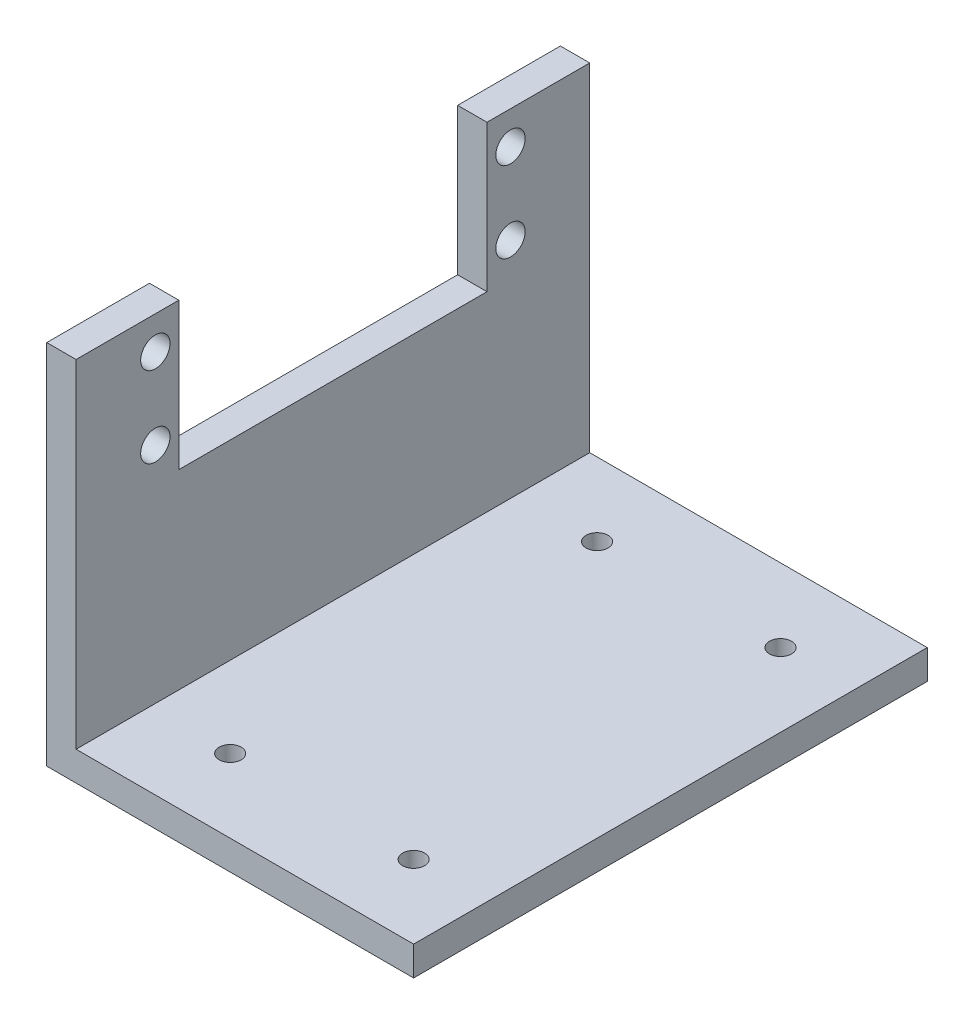
from build123d import *

# Parameters (mm, degrees)
EXTRUSION1_DEPTH                = 70
ESQUISSE2_W                     = 42
ESQUISSE2_H                     = 20
EXTRUSION2_DEPTH                = 70
ESQUISSE4_R                     = 1.5
EXTRUSION3_DEPTH                = 98.549987186
R_P_TITION_LIN_AIRE1_COUNT      = 2
R_P_TITION_LIN_AIRE1_PITCH      = 50
R_P_TITION_LIN_AIRE1_COUNT_DIR2 = 2
R_P_TITION_LIN_AIRE1_PITCH_DIR2 = 25
ESQUISSE5_R                     = 2
ENL_V_MAT_EXTRU_1_DEPTH         = 10
ESQUISSE6_R                     = 2
ENL_V_MAT_EXTRU_2_DEPTH         = 10
ESQUISSE7_R                     = 2
ENL_V_MAT_EXTRU_3_DEPTH         = 10
ESQUISSE8_R                     = 2
ENL_V_MAT_EXTRU_4_DEPTH         = 10


with BuildPart() as part:
    # Esquisse1 → Extrusion1 (new body)
    with BuildSketch(Plane.XY):
        Polygon((0, 0), (4, 0), (50, 0), (50, 4), (4, 4), (4, 50), (0, 50), align=None)
    extrude(amount=EXTRUSION1_DEPTH)

    # Esquisse2 → Extrusion2 (cut)
    with BuildSketch(Plane.ZY):
        with Locations((35, 40)):
            Rectangle(ESQUISSE2_W, ESQUISSE2_H)
    extrude(amount=-EXTRUSION2_DEPTH, mode=Mode.SUBTRACT)

    # Esquisse4 → Extrusion3 (cut, through all)
    with BuildSketch(Plane(origin=(0, 4, 0), x_dir=(1, 0, 0), z_dir=(0, 1, 0))):
        with Locations(Location((40, -60, 0), (0, 0, 270))):
            Circle(ESQUISSE4_R)
    extrusion3 = extrude(amount=-EXTRUSION3_DEPTH, mode=Mode.SUBTRACT)

    # Répétition linéaire1: Extrusion3 2 × 2
    with Locations(*[(-j * R_P_TITION_LIN_AIRE1_PITCH_DIR2, 0, -i * R_P_TITION_LIN_AIRE1_PITCH) for i in range(R_P_TITION_LIN_AIRE1_COUNT) for j in range(R_P_TITION_LIN_AIRE1_COUNT_DIR2) if (i, j) != (0, 0)]):
        add(extrusion3, mode=Mode.SUBTRACT)

    # Esquisse5 → Enlèv. mat.-Extru.1 (cut)
    with BuildSketch(Plane.ZY):
        with Locations((59.2, 45.5)):
            Circle(ESQUISSE5_R)
    extrude(amount=-ENL_V_MAT_EXTRU_1_DEPTH, mode=Mode.SUBTRACT)

    # Esquisse6 → Enlèv. mat.-Extru.2 (cut)
    with BuildSketch(Plane.ZY):
        with Locations((59.2, 34.5)):
            Circle(ESQUISSE6_R)
    extrude(amount=-ENL_V_MAT_EXTRU_2_DEPTH, mode=Mode.SUBTRACT)

    # Esquisse7 → Enlèv. mat.-Extru.3 (cut)
    with BuildSketch(Plane.ZY):
        with Locations((10.8, 34.5)):
            Circle(ESQUISSE7_R)
    extrude(amount=-ENL_V_MAT_EXTRU_3_DEPTH, mode=Mode.SUBTRACT)

    # Esquisse8 → Enlèv. mat.-Extru.4 (cut)
    with BuildSketch(Plane.ZY):
        with Locations((10.8, 45.5)):
            Circle(ESQUISSE8_R)
    extrude(amount=-ENL_V_MAT_EXTRU_4_DEPTH, mode=Mode.SUBTRACT)


solid = part.part
